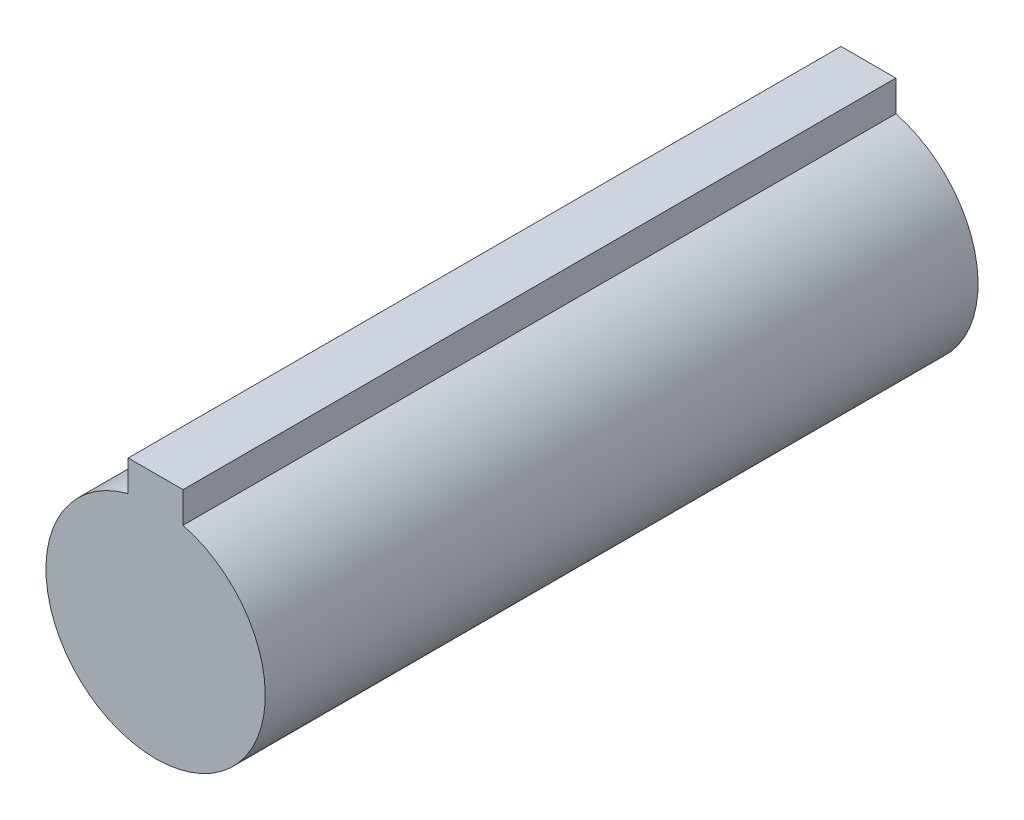
from build123d import *

# Parameters (mm, degrees)
EXTRUDE1_DEPTH      = 10
EXTRUDE1_DEPTH_BACK = 120


with BuildPart() as part:
    # Sketch1 → Extrude1 (new, two sides: drawn at the far end of the back side and taken through both)
    with BuildSketch(Plane.XY.offset(-EXTRUDE1_DEPTH_BACK)):
        with BuildLine():
            Line((-5, 25), (-5, 19.364916731))
            ThreePointArc((-5, 19.364916731), (0, -20), (5, 19.364916731))
            Line((5, 19.364916731), (5, 25))
            Line((5, 25), (-5, 25))
        make_face()
    extrude(amount=EXTRUDE1_DEPTH + EXTRUDE1_DEPTH_BACK)


solid = part.part
